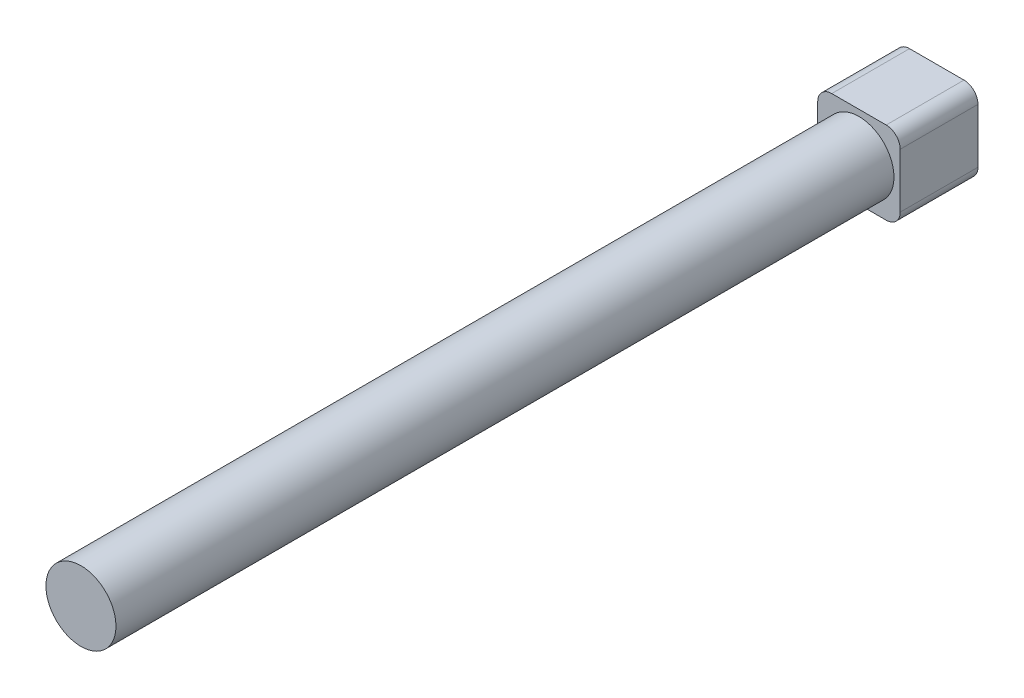
from build123d import *

# Parameters (mm, degrees)
BOSS_EXTRUDE1_DEPTH = 10
SKETCH2_R           = 4.5
BOSS_EXTRUDE2_DEPTH = 100


with BuildPart() as part:
    # Sketch1 → Boss-Extrude1 (new body)
    with BuildSketch(Plane.XY):
        with BuildLine():
            Line((0, -1.8), (0, -8.8))
            ThreePointArc((0, -8.8), (0.527207794, -10.072792206), (1.8, -10.6))
            Line((1.8, -10.6), (8.8, -10.6))
            ThreePointArc((8.8, -10.6), (10.072792206, -10.072792206), (10.6, -8.8))
            Line((10.6, -8.8), (10.6, -1.8))
            ThreePointArc((10.6, -1.8), (10.072792206, -0.527207794), (8.8, 0))
            Line((8.8, 0), (1.8, 0))
            ThreePointArc((1.8, 0), (0.527207794, -0.527207794), (0, -1.8))
        make_face()
    extrude(amount=BOSS_EXTRUDE1_DEPTH)

    # Sketch2 → Boss-Extrude2 (add)
    with BuildSketch(Plane.XY.offset(10)):
        with Locations((5.3, -5.3)):
            Circle(SKETCH2_R)
    extrude(amount=BOSS_EXTRUDE2_DEPTH)


solid = part.part
